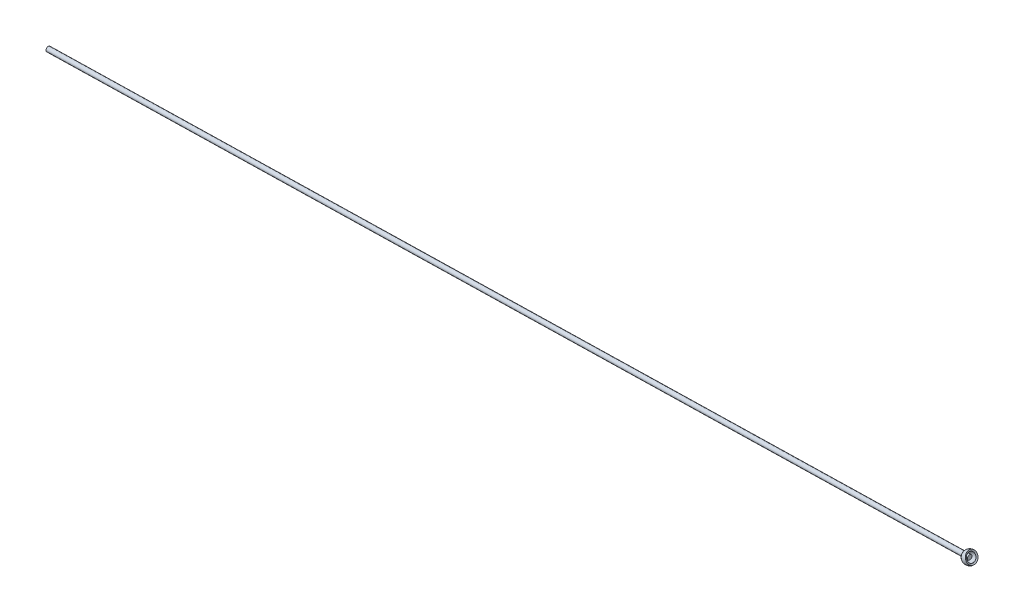
from build123d import *

# Parameters (mm, degrees)
ESQUISSE4_R        = 1.5
BOSS_EXTRU_1_DEPTH = 600


with BuildPart() as part:
    # Esquisse4 → Boss.-Extru.1 (new body)
    with BuildSketch(Plane(origin=(-291.161591592, -154.331808471, 0), x_dir=(0, 0, -1), z_dir=(0.9997509014565378, 0.022318938972097364, 0))):
        with Locations(Location((0, 0, 0), (0, 0, 90))):
            Circle(ESQUISSE4_R)
    extrude(amount=-BOSS_EXTRU_1_DEPTH)

    # Esquisse5 → Révol.-Mince1 (revolve)
    with BuildSketch(Plane.XY):
        with BuildLine():
            ThreePointArc((-291.514241878, -151.352607609), (-293.804281963, -152.911883259), (-293.840511157, -155.682138047))
            Line((-293.840511157, -155.682138047), (-294.733484345, -156.132247906))
            ThreePointArc((-294.733484345, -156.132247906), (-294.685178753, -152.438574855), (-291.631791973, -150.359540655))
            Line((-291.631791973, -150.359540655), (-291.514241878, -151.352607609))
        make_face()
    revolve(axis=Axis((-293.840511157, -155.682138047, 0), (0.8929731882535339, 0.45010985887927285, 0)))


solid = part.part
